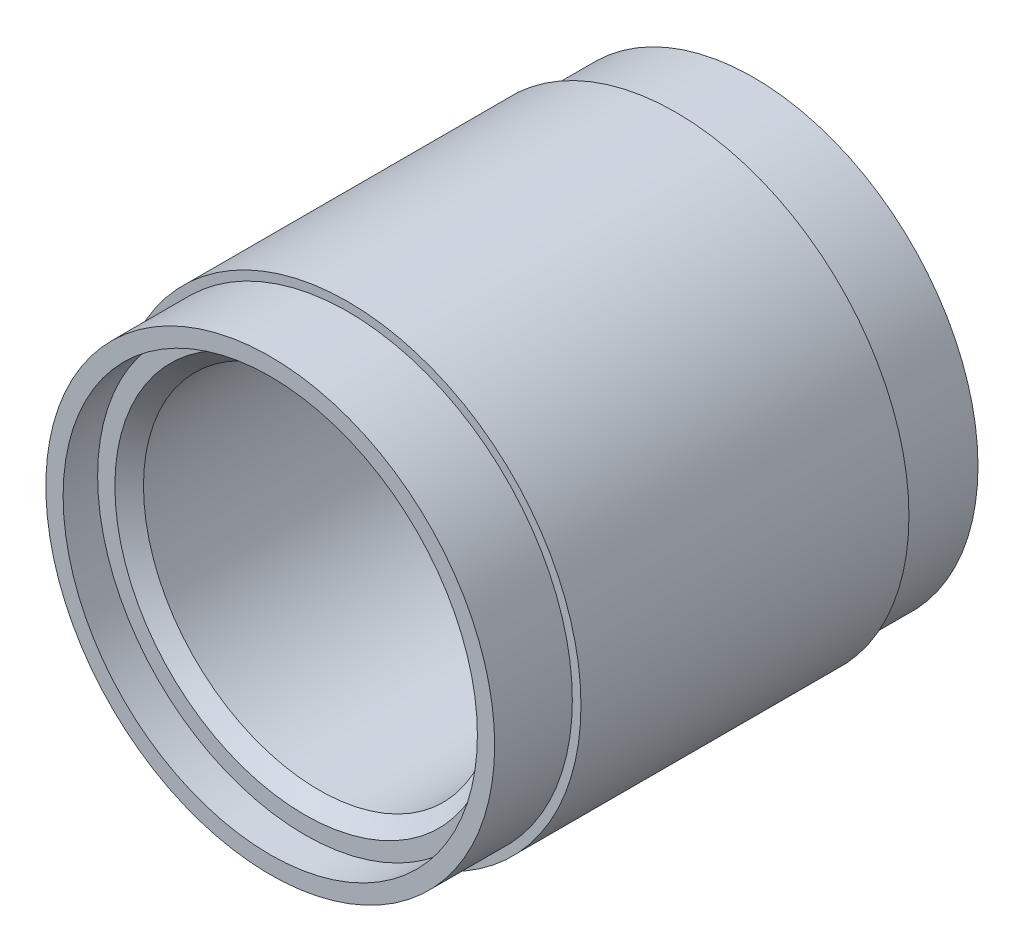
from build123d import *

# Parameters (mm, degrees)
SKETCH_2_R          = 13
EXTRUDE_1_DEPTH     = 4.5
SKETCH_3_R          = 13.5
EXTRUDE_2_DEPTH     = 9.5
SKETCH_4_R          = 12
CUT_EXTRUDE_1_DEPTH = 2
SKETCH_5_R          = 10.172
CUT_EXTRUDE_2_DEPTH = 33.256782233
CHAMFER_1_SIZE      = 0.828


with BuildPart() as part:
    # Эскиз2 → Бобышка-Вытянуть1 (new body)
    with BuildSketch(Plane.XY):
        Circle(SKETCH_2_R)
    extrude(amount=EXTRUDE_1_DEPTH)

    # Эскиз3 → Бобышка-Вытянуть2 (add)
    with BuildSketch(Plane.XY.offset(4.5)):
        Circle(SKETCH_3_R)
    extrude(amount=EXTRUDE_2_DEPTH)

    # Эскиз4 → Вырез-Вытянуть1 (cut)
    with BuildSketch(Plane(origin=(0, 0, 0), x_dir=(-1, 0, 0), z_dir=(0, 0, -1))):
        Circle(SKETCH_4_R)
    extrude(amount=-CUT_EXTRUDE_1_DEPTH, mode=Mode.SUBTRACT)

    # Зеркальное отражение4: part across plane


with BuildPart() as part_1:
    add(part.part)
    add(part.part.mirror(Plane.XY.offset(14)))

    # Эскиз5 → Вырез-Вытянуть2 (cut, through all)
    with BuildSketch(Plane(origin=(0, 0, 2), x_dir=(-1, 0, 0), z_dir=(0, 0, -1))):
        Circle(SKETCH_5_R)
    extrude(amount=-CUT_EXTRUDE_2_DEPTH, mode=Mode.SUBTRACT)

    # Фаска1
    chamfer_1_edges = [part_1.edges().sort_by_distance(p)[0] for p in [
        (10.172, 0, 26),
        (10.172, 0, 2),
    ]]
    chamfer(chamfer_1_edges, length=CHAMFER_1_SIZE)


solid = part_1.part
